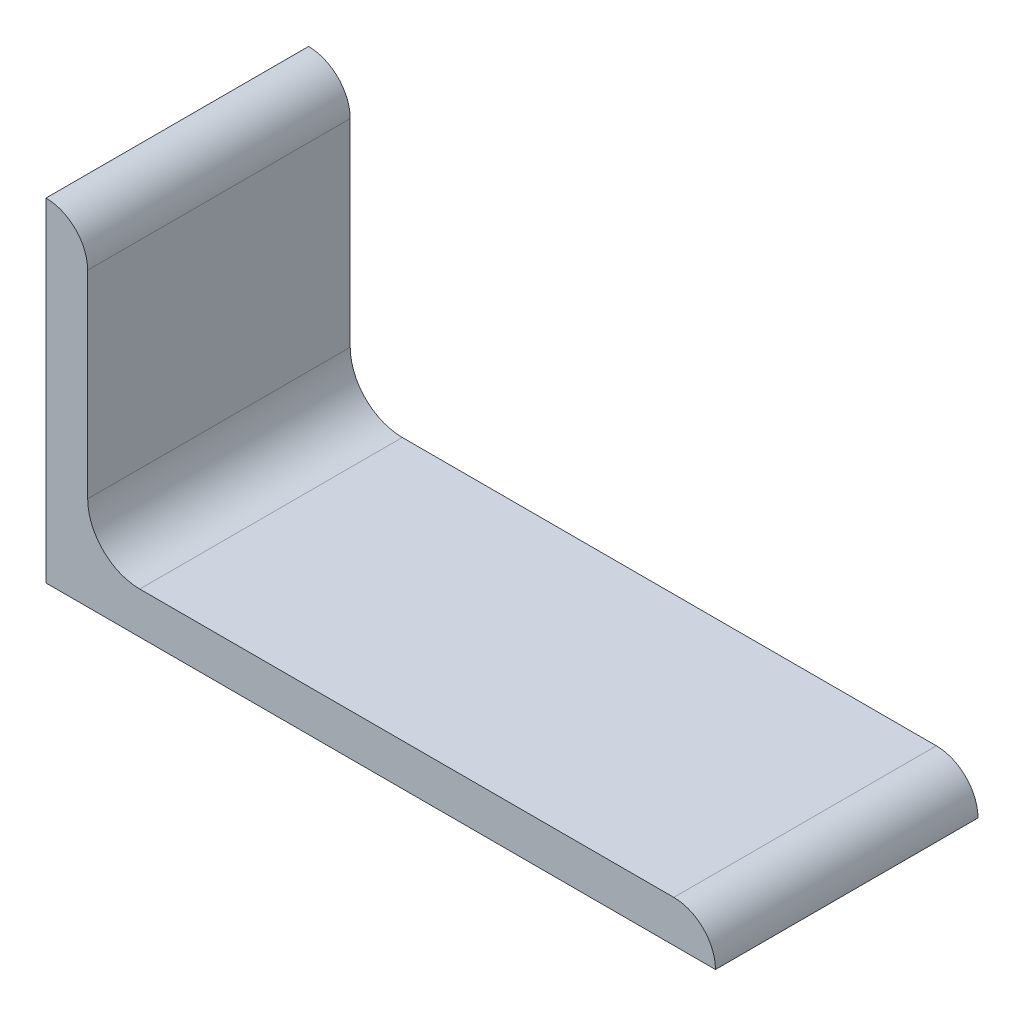
from build123d import *

# Parameters (mm, degrees)
HIERRO_ANGULAR_3_X_2_X_0_25_1_DEPTH = 40


with BuildPart() as part:
    # Sketch1 → Hierro angular 3 X 2 X 0.25(1) (new body)
    with BuildSketch(Plane.YX):
        with BuildLine():
            Line((0, 0), (0, 102))
            Line((0, 102), (0.00508, 102))
            ThreePointArc((0.00508, 102), (4.491615958, 100.141615958), (6.35, 95.65508))
            Line((6.35, 95.65508), (6.35, 14.2875))
            ThreePointArc((6.35, 14.2875), (8.674839924, 8.674839924), (14.2875, 6.35))
            Line((14.2875, 6.35), (44.45508, 6.35))
            ThreePointArc((44.45508, 6.35), (48.941615958, 4.491615958), (50.8, 0.00508))
            Line((50.8, 0.00508), (50.8, 0))
            Line((50.8, 0), (0, 0))
        make_face()
    extrude(amount=HIERRO_ANGULAR_3_X_2_X_0_25_1_DEPTH)


solid = part.part
